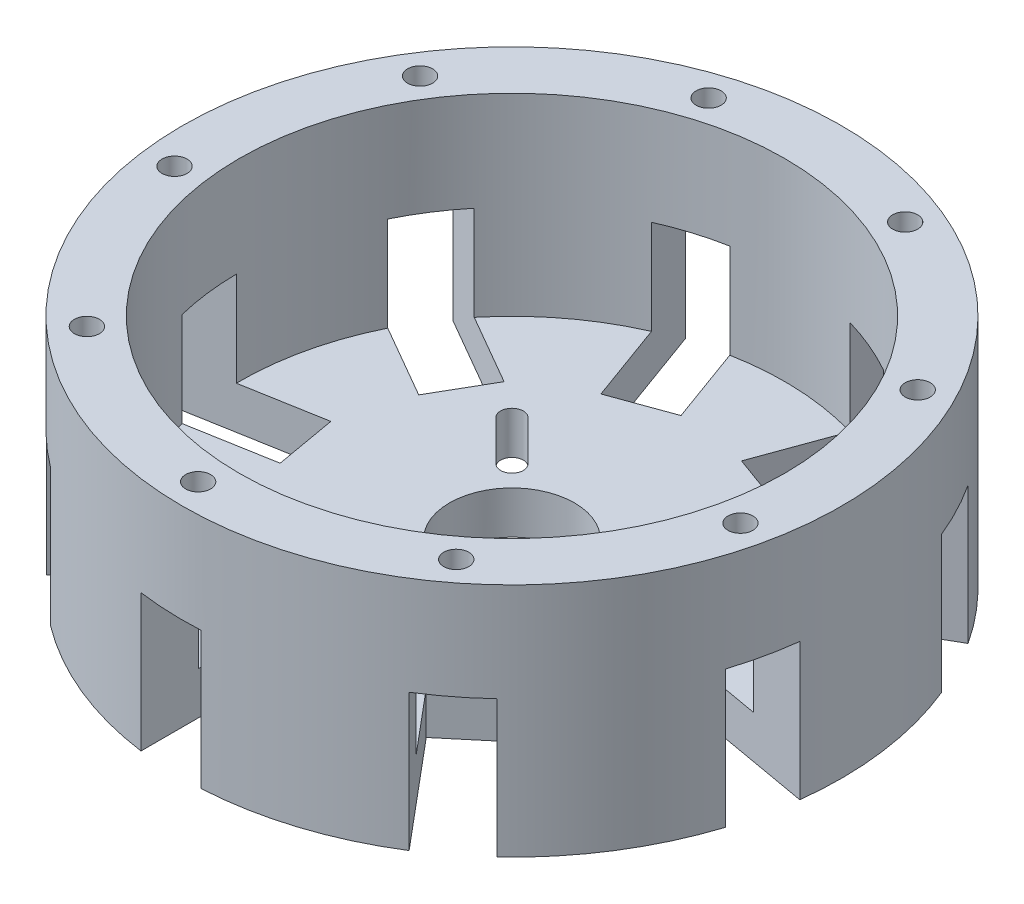
from build123d import *

# Parameters (mm, degrees)
SKETCH2_R           = 58
BOSS_EXTRUDE1_DEPTH = 41.5
SKETCH3_R           = 48
CUT_EXTRUDE1_DEPTH  = 34
SKETCH4_R           = 3.175
CUT_EXTRUDE2_DEPTH  = 89.791891522
CUT_EXTRUDE3_DEPTH  = 92.925241365
SKETCH6_W           = 11
SKETCH6_H           = 25.4
CUT_EXTRUDE4_DEPTH  = 25
CIRPATTERN1_COUNT   = 9
SKETCH7_R           = 2.2
CUT_EXTRUDE5_DEPTH  = 86.500040351
CIRPATTERN2_COUNT   = 9
SKETCH8_R           = 11
CUT_EXTRUDE6_DEPTH  = 92.925241365


with BuildPart() as part:
    # Sketch2 → Boss-Extrude1 (new body)
    with BuildSketch(Plane(origin=(0, 0, 0), x_dir=(1, 0, 0), z_dir=(0, 1, 0))):
        with Locations(Location((0, 0, 0), (0, 0, 270))):
            Circle(SKETCH2_R)
    extrude(amount=BOSS_EXTRUDE1_DEPTH)

    # Sketch3 → Cut-Extrude1 (cut)
    with BuildSketch(Plane(origin=(0, 41.5, 0), x_dir=(1, 0, 0), z_dir=(0, 1, 0))):
        with Locations(Location((0, 0, 0), (0, 0, 270))):
            Circle(SKETCH3_R)
    extrude(amount=-CUT_EXTRUDE1_DEPTH, mode=Mode.SUBTRACT)

    # Sketch4 → Cut-Extrude2 (cut, through all)
    with BuildSketch(Plane(origin=(0, 7.5, 0), x_dir=(1, 0, 0), z_dir=(0, 1, 0))):
        with Locations(Location((0, 0, 0), (0, 0, 270))):
            Circle(SKETCH4_R)
    extrude(amount=-CUT_EXTRUDE2_DEPTH, mode=Mode.SUBTRACT)

    # Sketch5 → Cut-Extrude3 (cut, through all)
    with BuildSketch(Plane.XZ):
        with BuildLine():
            Line((12.851665748, -10.023238623), (19.92273356, -17.094306435))
            ThreePointArc((19.92273356, -17.094306435), (19.92273356, -19.92273356), (17.094306435, -19.92273356))
            Line((17.094306435, -19.92273356), (10.023238623, -12.851665748))
            ThreePointArc((10.023238623, -12.851665748), (10.023238623, -10.023238623), (12.851665748, -10.023238623))
        make_face()
        with BuildLine():
            Line((10.023238623, 12.851665748), (17.094306435, 19.92273356))
            ThreePointArc((17.094306435, 19.92273356), (19.92273356, 19.92273356), (19.92273356, 17.094306435))
            Line((19.92273356, 17.094306435), (12.851665748, 10.023238623))
            ThreePointArc((12.851665748, 10.023238623), (10.023238623, 10.023238623), (10.023238623, 12.851665748))
        make_face()
        with BuildLine():
            Line((-10.023238623, 12.851665748), (-17.094306435, 19.92273356))
            ThreePointArc((-17.094306435, 19.92273356), (-19.92273356, 19.92273356), (-19.92273356, 17.094306435))
            Line((-19.92273356, 17.094306435), (-12.851665748, 10.023238623))
            ThreePointArc((-12.851665748, 10.023238623), (-10.023238623, 10.023238623), (-10.023238623, 12.851665748))
        make_face()
        with BuildLine():
            Line((-12.851665748, -10.023238623), (-19.92273356, -17.094306435))
            ThreePointArc((-19.92273356, -17.094306435), (-19.92273356, -19.92273356), (-17.094306435, -19.92273356))
            Line((-17.094306435, -19.92273356), (-10.023238623, -12.851665748))
            ThreePointArc((-10.023238623, -12.851665748), (-10.023238623, -10.023238623), (-12.851665748, -10.023238623))
        make_face()
    extrude(amount=-CUT_EXTRUDE3_DEPTH, mode=Mode.SUBTRACT)

    # Sketch6 → Cut-Extrude4 (cut)
    with BuildSketch(Plane.XY.offset(58.000000078)):
        with Locations((-2.325, 11.43)):
            Rectangle(SKETCH6_W, SKETCH6_H)
    cut_extrude4 = extrude(amount=-CUT_EXTRUDE4_DEPTH, mode=Mode.SUBTRACT)

    # CirPattern1: Cut-Extrude4 ×9 about axis
    cirpattern1_axis = Axis((0, 0, 0), (0, 1, 0))
    for i in range(1, CIRPATTERN1_COUNT):
        add(cut_extrude4.rotate(cirpattern1_axis, i * 360 / CIRPATTERN1_COUNT), mode=Mode.SUBTRACT)

    # Sketch7 → Cut-Extrude5 (cut, through all)
    with BuildSketch(Plane.XZ.offset(-24.13)):
        with Locations(Location((-2.335541758, 52.90395562, 0), (0, 0, 270))):
            Circle(SKETCH7_R)
    cut_extrude5 = extrude(amount=-CUT_EXTRUDE5_DEPTH, mode=Mode.SUBTRACT)

    # CirPattern2: Cut-Extrude5 ×9 about axis
    cirpattern2_axis = Axis((0, 0, 0), (0, 1, 0))
    for i in range(1, CIRPATTERN2_COUNT):
        add(cut_extrude5.rotate(cirpattern2_axis, i * 360 / CIRPATTERN2_COUNT), mode=Mode.SUBTRACT)

    # Sketch8 → Cut-Extrude6 (cut, through all)
    with BuildSketch(Plane.XZ):
        with Locations(Location((0, 0, 0), (0, 0, 270))):
            Circle(SKETCH8_R)
    extrude(amount=-CUT_EXTRUDE6_DEPTH, mode=Mode.SUBTRACT)


solid = part.part
